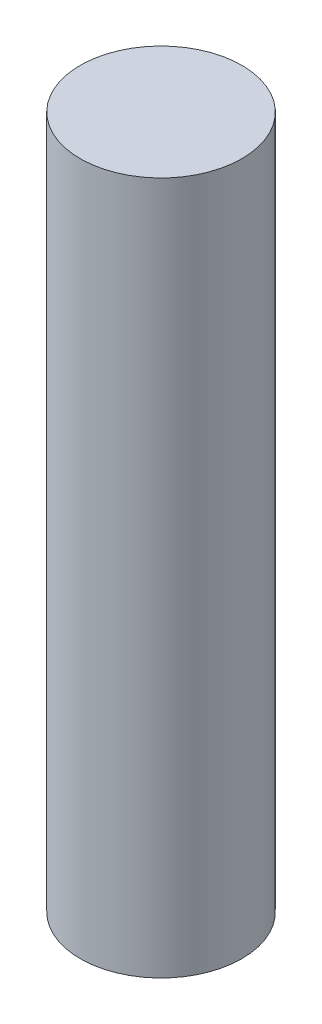
from build123d import *

# Parameters (mm, degrees)
SKETCH1_R           = 7
SKETCH1_R_2         = 5
EXTRUDE_THIN2_DEPTH = 60
BOSS_EXTRUDE4_START = -30
SKETCH2_R           = 5
BOSS_EXTRUDE4_DEPTH = 30


with BuildPart() as part:
    # Sketch1 → Extrude-Thin2 (new body)
    with BuildSketch(Plane(origin=(0, 0, 0), x_dir=(1, 0, 0), z_dir=(0, 1, 0))):
        Circle(SKETCH1_R)
        Circle(SKETCH1_R_2, mode=Mode.SUBTRACT)
    extrude(amount=EXTRUDE_THIN2_DEPTH)

    # Sketch2 → Boss-Extrude4 (add)
    with BuildSketch(Plane(origin=(0, 60, 0), x_dir=(1, 0, 0), z_dir=(0, 1, 0)).offset(BOSS_EXTRUDE4_START)):
        with Locations(Location((0, 0, 0), (0, 0, 270))):
            Circle(SKETCH2_R)
    extrude(amount=BOSS_EXTRUDE4_DEPTH)


solid = part.part
